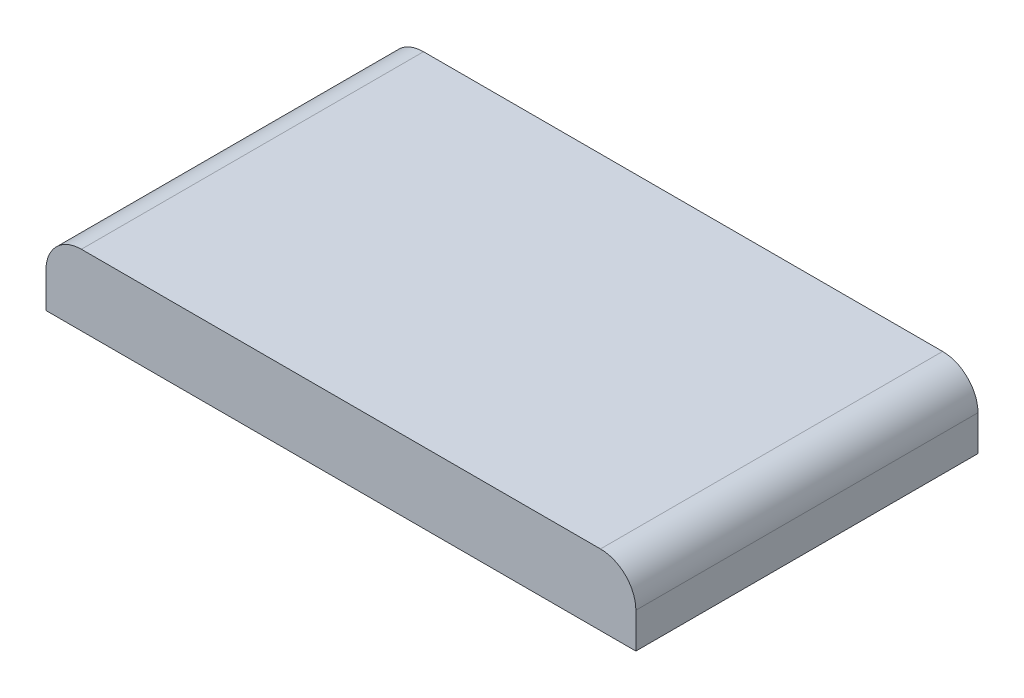
from build123d import *

# Parameters (mm, degrees)
SKETCH1_W           = 127
SKETCH1_H           = 73.66
BOSS_EXTRUDE1_DEPTH = 15.24
FILLET1_R           = 7.62


with BuildPart() as part:
    # Sketch1 → Boss-Extrude1 (new body)
    with BuildSketch(Plane(origin=(0, 0, 0), x_dir=(1, 0, 0), z_dir=(0, 1, 0))):
        with Locations((-57.888052689, 46.764936709)):
            Rectangle(SKETCH1_W, SKETCH1_H)
    extrude(amount=BOSS_EXTRUDE1_DEPTH)

    # Fillet1
    fillet1_edges = [part.edges().sort_by_distance(p)[0] for p in [
        (5.611947311, 15.24, -46.764936709),
        (-121.388052689, 15.24, -46.764936709),
    ]]
    fillet(fillet1_edges, radius=FILLET1_R)


solid = part.part
